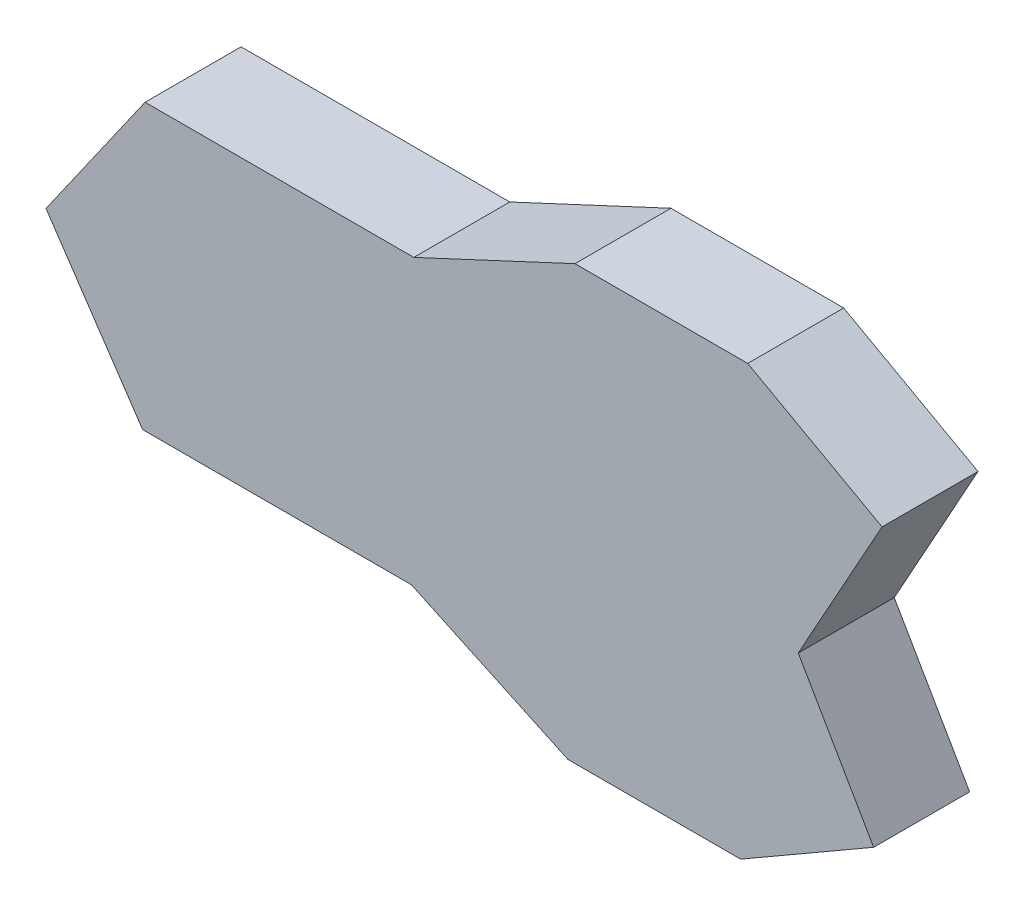
from build123d import *

# Parameters (mm, degrees)
BOSS_EXTRUDE1_DEPTH = 63.5


with BuildPart() as part:
    # Sketch1 → Boss-Extrude1 (new, symmetric)
    with BuildSketch(Plane.XY):
        Polygon((0, 0), (-355.6, 0), (-483.431497733, 189.517989086), (-352.311924384, 376.776146411), (3.288075616, 376.776146411), (216.516859643, 476.206361341), (445.116859643, 476.206361341), (622.839584133, 377.693046507), (512.012104945, 177.754981455), (611.758322166, 4.989465366), (435.781960117, -96.610534634), (207.181960117, -96.610534634), align=None)
    extrude(amount=BOSS_EXTRUDE1_DEPTH, both=True)


solid = part.part
